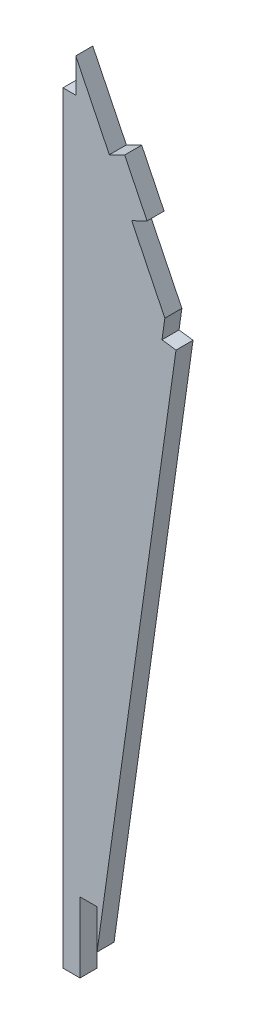
from build123d import *

# Parameters (mm, degrees)
EXTRUDE_1_DEPTH = 2


with BuildPart() as part:
    # 草图1 → 凸台-拉伸1 (new body)
    with BuildSketch(Plane.XY):
        Polygon((6.494974155, 96.888801997), (6.494974155, 92.888801997), (4.994974155, 92.888801997), (4.994974155, 3.339543319), (6.994974155, 3.339543319), (6.994974155, 11.589543319), (8.994974155, 11.589543319), (8.994974155, 6.981191281), (18.268024931, 72.846238904), (16.626474953, 73.077430022), (16.958549535, 75.435293199), (13.070541357, 83.406891303), (14.86812945, 84.283633596), (12.237902569, 89.676397874), (10.440314476, 88.79965558), align=None)
    extrude(amount=EXTRUDE_1_DEPTH)


solid = part.part
